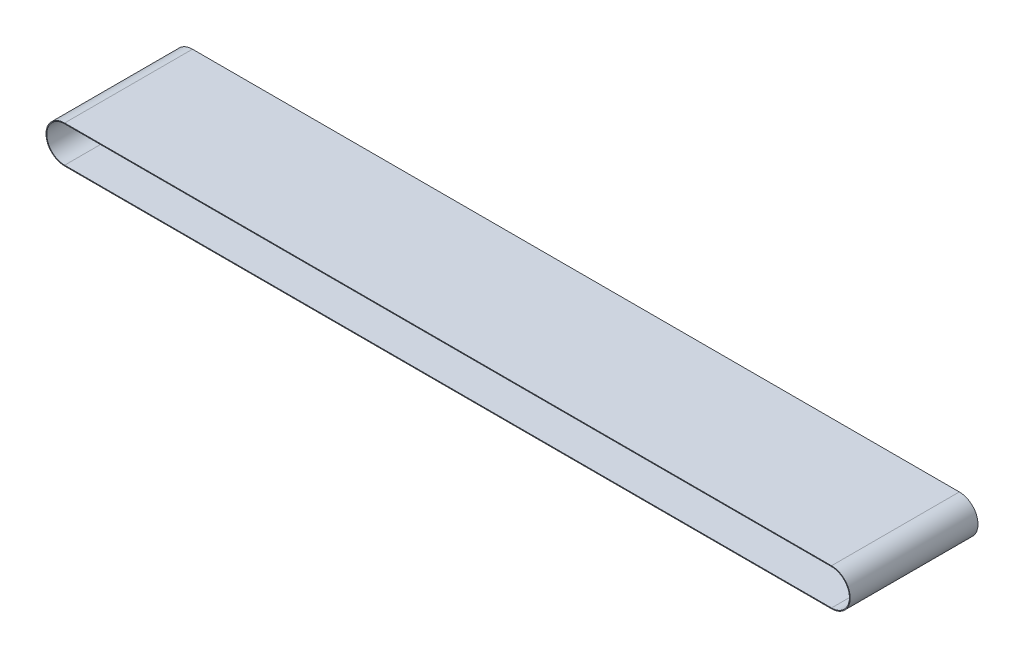
from build123d import *

# Parameters (mm, degrees)
Y_KSEKLIK_EKSTR_ZYON1_DEPTH = 500


with BuildPart() as part:
    # Çizim1 → Yükseklik-Ekstrüzyon1 (new body)
    with BuildSketch(Plane.XY):
        with BuildLine():
            Line((-1500, 73), (1500, 73))
            ThreePointArc((1500, 73), (1573, 0), (1500, -73))
            Line((1500, -73), (-1500, -73))
            ThreePointArc((-1500, -73), (-1573, 0), (-1500, 73))
        make_face()
        with BuildLine():
            Line((-1500, 70), (1500, 70))
            ThreePointArc((1500, 70), (1570, 0), (1500, -70))
            Line((1500, -70), (-1500, -70))
            ThreePointArc((-1500, -70), (-1570, 0), (-1500, 70))
        make_face(mode=Mode.SUBTRACT)
    extrude(amount=Y_KSEKLIK_EKSTR_ZYON1_DEPTH)


solid = part.part
